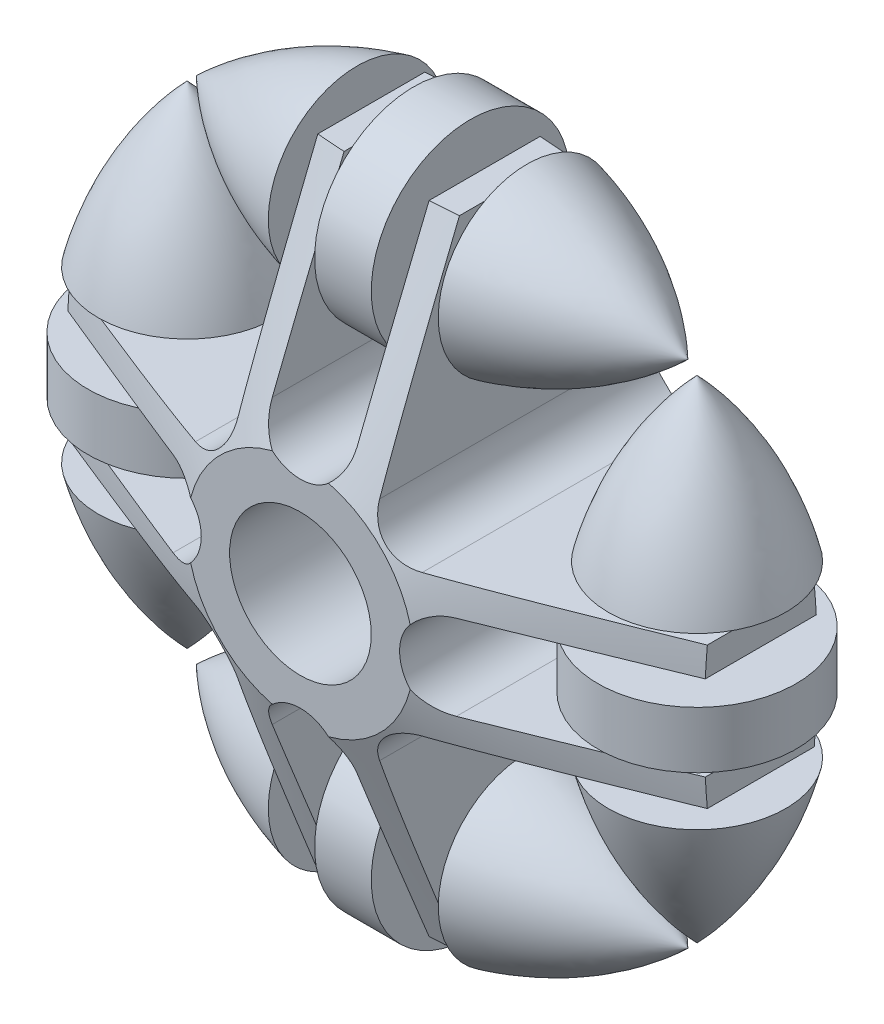
from build123d import *

# Parameters (mm, degrees)
SKETCH_1_R               = 5
EXTRUDE_1_DEPTH          = 10
SKETCH_3_R               = 7
EXTRUDE_2_DEPTH          = 2
PATTERN_CIRCULAR_1_COUNT = 4
PATTERN_CIRCULAR_3_COUNT = 4
PATTERN_CIRCULAR_4_COUNT = 4


with BuildPart() as part:
    # 草图1 → 凸台-拉伸1 (new, symmetric)
    with BuildSketch(Plane.XY):
        with BuildLine():
            Line((-5, 22.5), (-3, 22.5))
            Line((-3, 22.5), (-3, 10))
            ThreePointArc((-3, 10), (0, 7), (3, 10))
            Line((3, 10), (3, 22.5))
            Line((3, 22.5), (5, 22.5))
            Line((5, 22.5), (5, 8))
            ThreePointArc((5, 8), (5.878679656, 5.878679656), (8, 5))
            Line((8, 5), (22.5, 5))
            Line((22.5, 5), (22.5, 3))
            Line((22.5, 3), (10, 3))
            ThreePointArc((10, 3), (7, 0), (10, -3))
            Line((10, -3), (22.5, -3))
            Line((22.5, -3), (22.5, -5))
            Line((22.5, -5), (8, -5))
            ThreePointArc((8, -5), (5.878679656, -5.878679656), (5, -8))
            Line((5, -8), (5, -22.5))
            Line((5, -22.5), (3, -22.5))
            Line((3, -22.5), (3, -10))
            ThreePointArc((3, -10), (0, -7), (-3, -10))
            Line((-3, -10), (-3, -22.5))
            Line((-3, -22.5), (-5, -22.5))
            Line((-5, -22.5), (-5, -8))
            ThreePointArc((-5, -8), (-5.878679656, -5.878679656), (-8, -5))
            Line((-8, -5), (-22.5, -5))
            Line((-22.5, -5), (-22.5, -3))
            Line((-22.5, -3), (-10, -3))
            ThreePointArc((-10, -3), (-7, 0), (-10, 3))
            Line((-10, 3), (-22.5, 3))
            Line((-22.5, 3), (-22.5, 5))
            Line((-22.5, 5), (-8, 5))
            ThreePointArc((-8, 5), (-5.878679656, 5.878679656), (-5, 8))
            Line((-5, 8), (-5, 22.5))
        make_face()
        Circle(SKETCH_1_R, mode=Mode.SUBTRACT)
    extrude(amount=EXTRUDE_1_DEPTH, both=True)

    # 草图2 → 切除-旋转1 (revolve, cut)
    with BuildSketch(Plane(origin=(0, 0, 0), x_dir=(0, 0, -1), z_dir=(1, 0, 0))):
        Polygon((-10, 8), (-10, 24.367272037), (-3.227335709, 24.367272037), align=None)
        Polygon((3.227335709, 24.367272037), (10, 8), (10, 24.367272037), align=None)
    revolve(axis=Axis((0, 0, 10), (0, 0, -1)), mode=Mode.SUBTRACT)


with BuildPart() as body_2:
    # 草图3 → 凸台-拉伸2 (new, symmetric)
    with BuildSketch(Plane(origin=(0, 0, 0), x_dir=(0, 0, -1), z_dir=(1, 0, 0))):
        with Locations((0, 18)):
            Circle(SKETCH_3_R)
    extrude(amount=EXTRUDE_2_DEPTH, both=True)


with BuildPart() as pattern_circular_1_1:
    # 阵列(圆周)1: pattern copy
    add(body_2.part.rotate(Axis((0, 0, 0), (0, 0, 1)), 1 * 360 / PATTERN_CIRCULAR_1_COUNT))


with BuildPart() as pattern_circular_1_2:
    # 阵列(圆周)1: pattern copy
    add(body_2.part.rotate(Axis((0, 0, 0), (0, 0, 1)), 2 * 360 / PATTERN_CIRCULAR_1_COUNT))


with BuildPart() as pattern_circular_1_3:
    # 阵列(圆周)1: pattern copy
    add(body_2.part.rotate(Axis((0, 0, 0), (0, 0, 1)), 3 * 360 / PATTERN_CIRCULAR_1_COUNT))


with BuildPart() as body_6:
    # 草图4 → 旋转1 (revolve)
    with BuildSketch(Plane.XY):
        with BuildLine():
            Line((6, 24.269322199), (6, 18))
            Line((6, 18), (17.349351573, 18))
            ThreePointArc((17.349351573, 18), (12.088182449, 21.883232053), (6, 24.269322199))
        make_face()
    revolve(axis=Axis((2, 18, 0), (1, 0, 0)))


with BuildPart() as pattern_circular_3_1:
    # 阵列(圆周)3: pattern copy
    add(body_6.part.rotate(Axis((0, 0, 0), (0, 0, 1)), 1 * 360 / PATTERN_CIRCULAR_3_COUNT))


with BuildPart() as pattern_circular_3_2:
    # 阵列(圆周)3: pattern copy
    add(body_6.part.rotate(Axis((0, 0, 0), (0, 0, 1)), 2 * 360 / PATTERN_CIRCULAR_3_COUNT))


with BuildPart() as pattern_circular_3_3:
    # 阵列(圆周)3: pattern copy
    add(body_6.part.rotate(Axis((0, 0, 0), (0, 0, 1)), 3 * 360 / PATTERN_CIRCULAR_3_COUNT))


with BuildPart() as body_10:
    # 镜向1: mirrored copy
    add(body_6.part.mirror(Plane(origin=(0, 0, 0), x_dir=(0, 0, 1), z_dir=(1, 0, 0))))


with BuildPart() as pattern_circular_4_1:
    # 阵列(圆周)4: pattern copy
    add(body_10.part.rotate(Axis((0, 0, 0), (0, 0, 1)), 1 * 360 / PATTERN_CIRCULAR_4_COUNT))


with BuildPart() as pattern_circular_4_2:
    # 阵列(圆周)4: pattern copy
    add(body_10.part.rotate(Axis((0, 0, 0), (0, 0, 1)), 2 * 360 / PATTERN_CIRCULAR_4_COUNT))


with BuildPart() as pattern_circular_4_3:
    # 阵列(圆周)4: pattern copy
    add(body_10.part.rotate(Axis((0, 0, 0), (0, 0, 1)), 3 * 360 / PATTERN_CIRCULAR_4_COUNT))


solid = Compound([part.part, body_2.part, pattern_circular_1_1.part, pattern_circular_1_2.part, pattern_circular_1_3.part, body_6.part, pattern_circular_3_1.part, pattern_circular_3_2.part, pattern_circular_3_3.part, body_10.part, pattern_circular_4_1.part, pattern_circular_4_2.part, pattern_circular_4_3.part])
